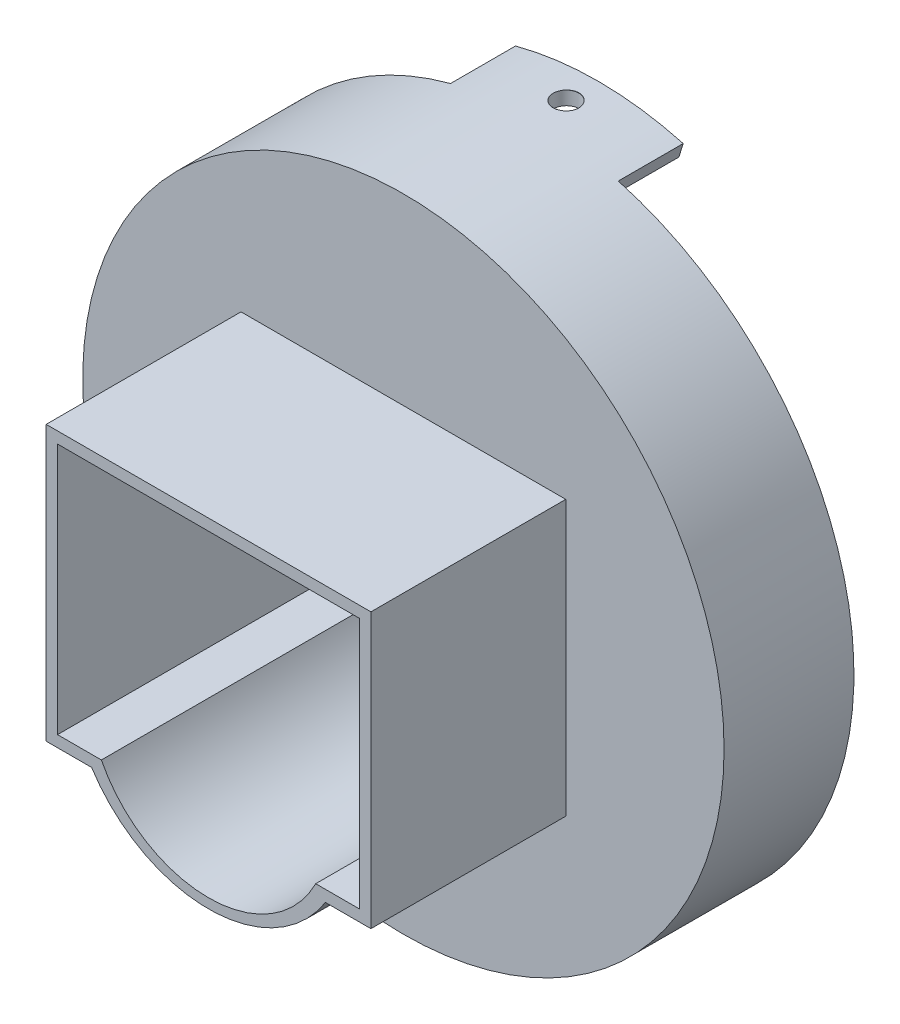
from build123d import *

# Parameters (mm, degrees)
SKETCH1_R                       = 50.165
BOSS_EXTRUDE1_DEPTH             = 20.32
SKETCH4_W                       = 6.858
SKETCH4_H                       = 39.37
BOSS_EXTRUDE3_DEPTH             = 7.62
BOSS_EXTRUDE4_DEPTH             = 30.48
BOSS_EXTRUDE5_START             = -30.48
BOSS_EXTRUDE5_DEPTH             = 30.48
F_4_0MM_DOWEL_HOLE1_D           = 4
F_4_0MM_DOWEL_HOLE1_CSINK_D     = 4.05
F_4_0MM_DOWEL_HOLE1_CSINK_ANGLE = 100


with BuildPart() as part:
    # Sketch1 → Boss-Extrude1 (new body)
    with BuildSketch(Plane.XY):
        Circle(SKETCH1_R)
        with BuildLine():
            Line((16.764, -19.685), (23.622, -19.685))
            Line((23.622, -19.685), (23.622, 19.685))
            Line((23.622, 19.685), (-23.622, 19.685))
            Line((-23.622, 19.685), (-23.622, -19.685))
            Line((-23.622, -19.685), (-16.764, -19.685))
            ThreePointArc((-16.764, -19.685), (0, -29.980534), (16.764, -19.685))
        make_face(mode=Mode.SUBTRACT)
    extrude(amount=BOSS_EXTRUDE1_DEPTH)

    # Sketch4 → Boss-Extrude3 (add)
    with BuildSketch(Plane(origin=(0, 0, 0), x_dir=(-1, 0, 0), z_dir=(0, 0, -1))):
        with Locations((-20.193, 0)):
            Rectangle(SKETCH4_W, SKETCH4_H)
        with Locations((20.193, 0)):
            Rectangle(SKETCH4_W, SKETCH4_H)
    extrude(amount=-BOSS_EXTRUDE3_DEPTH)

    # Sketch5 → Boss-Extrude4 (add)
    with BuildSketch(Plane.XY.offset(20.32)):
        with BuildLine():
            Line((18.288, -21.463), (25.4, -21.463))
            Line((25.4, -21.463), (25.4, 21.463))
            Line((25.4, 21.463), (-25.4, 21.463))
            Line((-25.4, 21.463), (-25.4, -21.463))
            Line((-25.4, -21.463), (-18.288, -21.463))
            ThreePointArc((-18.288, -21.463), (0, -31.496), (18.288, -21.463))
        make_face()
        with BuildLine():
            Line((-23.622, -19.685), (-16.764, -19.685))
            ThreePointArc((-16.764, -19.685), (0, -29.980534), (16.764, -19.685))
            Line((16.764, -19.685), (23.622, -19.685))
            Line((23.622, -19.685), (23.622, 19.685))
            Line((23.622, 19.685), (-23.622, 19.685))
            Line((-23.622, 19.685), (-23.622, -19.685))
        make_face(mode=Mode.SUBTRACT)
    extrude(amount=BOSS_EXTRUDE4_DEPTH)

    # Sketch6 → Boss-Extrude5 (add)
    with BuildSketch(Plane.XY.offset(20.32).offset(BOSS_EXTRUDE5_START)):
        with BuildLine():
            Line((13.809067, -48.226931), (13.494533, -45.962673))
            ThreePointArc((13.494533, -45.962673), (0.162084, -47.884774), (-13.179793, -46.029248))
            Line((-13.179793, -46.029248), (-13.809067, -48.226931))
            ThreePointArc((-13.809067, -48.226931), (0, -50.165), (13.809067, -48.226931))
        make_face()
        with BuildLine():
            Line((-12.942511, 48.466675), (-12.507062, 46.222532))
            ThreePointArc((-12.507062, 46.222532), (0.054768, 48.038228), (12.611794, 46.189603))
            Line((12.611794, 46.189603), (13.2937, 48.371528))
            ThreePointArc((13.2937, 48.371528), (0.181925, 50.16467), (-12.942511, 48.466675))
        make_face()
    extrude(amount=BOSS_EXTRUDE5_DEPTH)

    # Ø4.0mm Dowel Hole1 (through all)
    with Locations(Plane(origin=(0.064319, 50.164959, -5.053713), x_dir=(0.999999178055, -0.001282142203, 0), z_dir=(0.001282142203, 0.999999178055, 0))):
        with Locations((0, 0)):
            CounterSinkHole(F_4_0MM_DOWEL_HOLE1_D / 2, F_4_0MM_DOWEL_HOLE1_CSINK_D / 2, counter_sink_angle=F_4_0MM_DOWEL_HOLE1_CSINK_ANGLE)


solid = part.part
